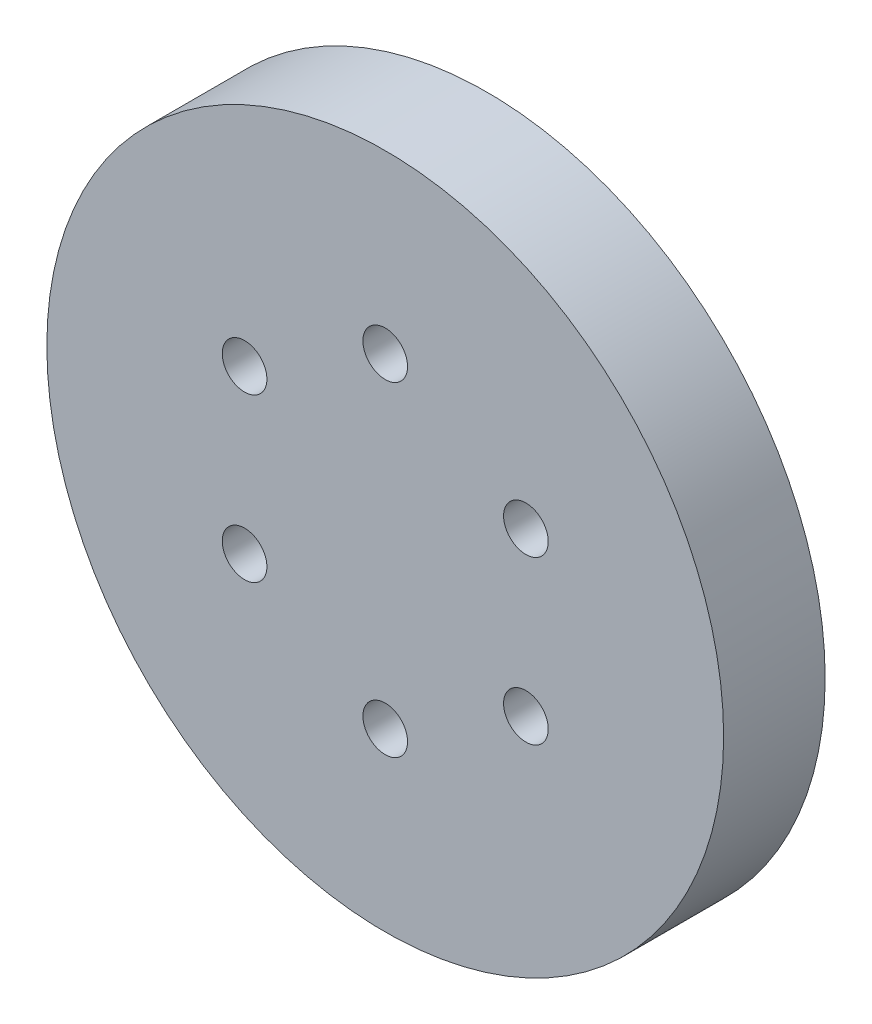
from build123d import *

# Parameters (mm, degrees)
SKETCH_1_R      = 25
SKETCH_1_R_2    = 1.65
EXTRUDE_1_DEPTH = 7.5


with BuildPart() as part:
    # 草图1 → 凸台-拉伸1 (new body)
    with BuildSketch(Plane.XY):
        Circle(SKETCH_1_R)
        with Locations((0, 12)):
            Circle(SKETCH_1_R_2, mode=Mode.SUBTRACT)
        with Locations((10.392304845, 6)):
            Circle(SKETCH_1_R_2, mode=Mode.SUBTRACT)
        with Locations((10.392304845, -6)):
            Circle(SKETCH_1_R_2, mode=Mode.SUBTRACT)
        with Locations((0, -12)):
            Circle(SKETCH_1_R_2, mode=Mode.SUBTRACT)
        with Locations((-10.392304845, -6)):
            Circle(SKETCH_1_R_2, mode=Mode.SUBTRACT)
        with Locations((-10.392304845, 6)):
            Circle(SKETCH_1_R_2, mode=Mode.SUBTRACT)
    extrude(amount=EXTRUDE_1_DEPTH)


solid = part.part
